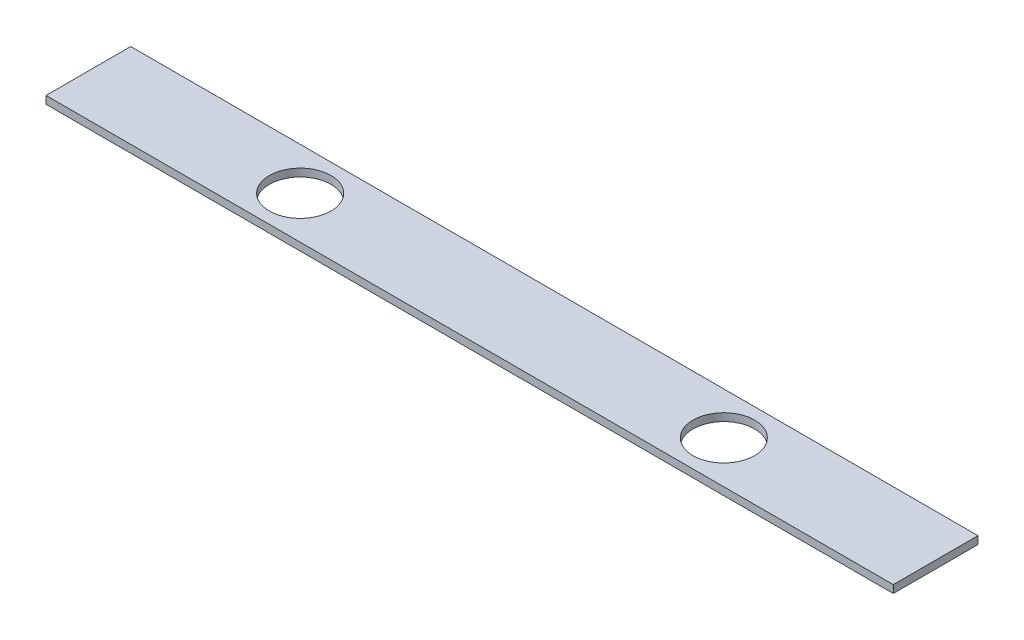
from build123d import *

# Parameters (mm, degrees)
SZKIC1_W                    = 220
SZKIC1_H                    = 22
SZKIC1_R                    = 8
DODANIE_WYCI_GNI_CIE1_DEPTH = 2


with BuildPart() as part:
    # Szkic1 → Dodanie-wyciągnięcie1 (new body)
    with BuildSketch(Plane(origin=(0, 0, 0), x_dir=(1, 0, 0), z_dir=(0, 1, 0))):
        with Locations((110, 11)):
            Rectangle(SZKIC1_W, SZKIC1_H)
        with Locations(Location((165, 11, 0), (0, 0, 270))):
            Circle(SZKIC1_R, mode=Mode.SUBTRACT)
        with Locations(Location((55, 11, 0), (0, 0, 270))):
            Circle(SZKIC1_R, mode=Mode.SUBTRACT)
    extrude(amount=DODANIE_WYCI_GNI_CIE1_DEPTH)


solid = part.part
